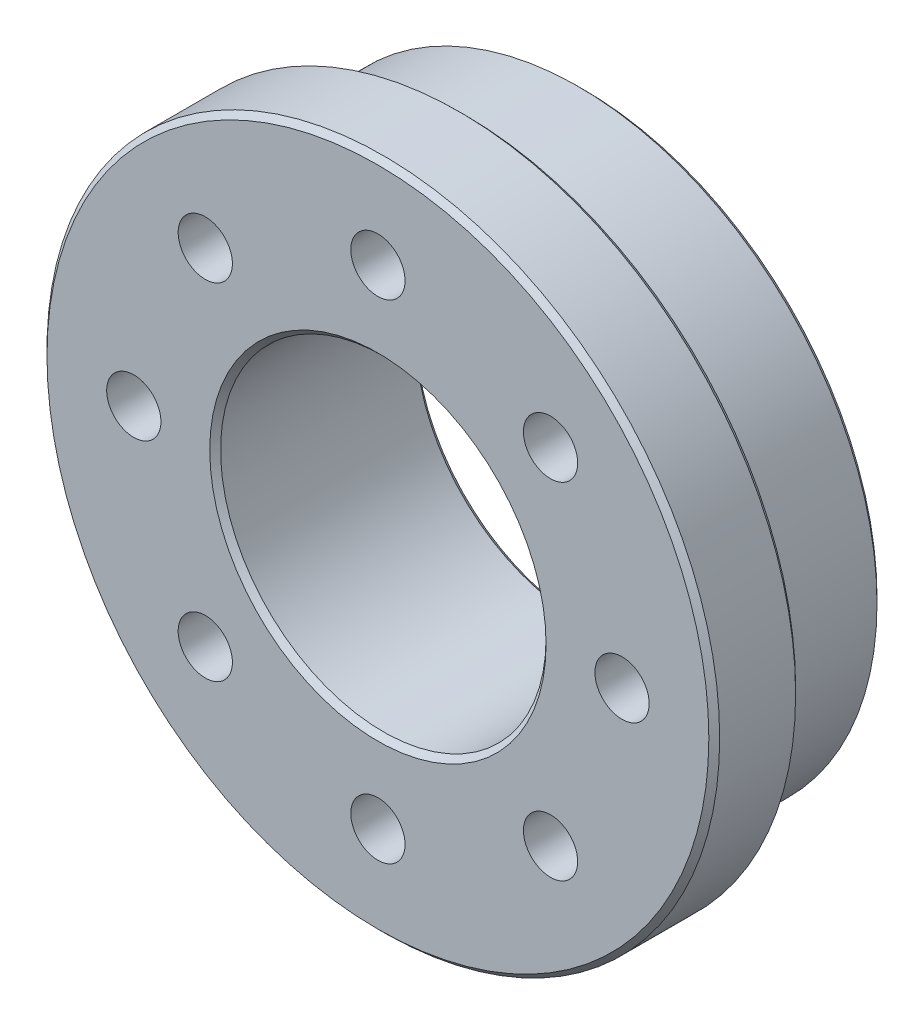
from build123d import *

# Parameters (mm, degrees)
SKETCH_1_R          = 27.5
EXTRUDE_1_DEPTH     = 11
SKETCH_2_R          = 31
EXTRUDE_2_DEPTH     = 8
SKETCH_3_R          = 2.5
CUT_EXTRUDE_1_DEPTH = 15
SKETCH_4_R          = 15
CUT_EXTRUDE_2_DEPTH = 48.780749262
CHAMFER_1_SIZE      = 0.5
CHAMFER_2_SIZE      = 0.5


with BuildPart() as part:
    # 草图1 → 拉伸1 (new body)
    with BuildSketch(Plane.XY):
        Circle(SKETCH_1_R)
    extrude(amount=EXTRUDE_1_DEPTH)

    # 草图2 → 拉伸2 (add)
    with BuildSketch(Plane.XY.offset(11)):
        Circle(SKETCH_2_R)
    extrude(amount=EXTRUDE_2_DEPTH)

    # 草图3 → 切除-拉伸1 (cut)
    with BuildSketch(Plane.XY.offset(19)):
        with Locations((0, 22.5)):
            Circle(SKETCH_3_R)
        with Locations((15.909902577, 15.909902577)):
            Circle(SKETCH_3_R)
        with Locations((22.5, 0)):
            Circle(SKETCH_3_R)
        with Locations((15.909902577, -15.909902577)):
            Circle(SKETCH_3_R)
        with Locations((0, -22.5)):
            Circle(SKETCH_3_R)
        with Locations((-15.909902577, -15.909902577)):
            Circle(SKETCH_3_R)
        with Locations((-22.5, 0)):
            Circle(SKETCH_3_R)
        with Locations((-15.909902577, 15.909902577)):
            Circle(SKETCH_3_R)
    extrude(amount=-CUT_EXTRUDE_1_DEPTH, mode=Mode.SUBTRACT)

    # 草图4 → 切除-拉伸2 (cut, through all)
    with BuildSketch(Plane.XY.offset(19)):
        Circle(SKETCH_4_R)
    extrude(amount=-CUT_EXTRUDE_2_DEPTH, mode=Mode.SUBTRACT)

    # 倒角1
    chamfer_1_edges = [part.edges().sort_by_distance(p)[0] for p in [
        (-27.5, 0, 0),
        (-15, 0, 0),
        (-31, 0, 11),
        (-31, 0, 19),
    ]]
    chamfer(chamfer_1_edges, length=CHAMFER_1_SIZE)

    # 倒角2
    chamfer_2_edges = [part.edges().sort_by_distance(p)[0] for p in [
        (-15, 0, 19),
    ]]
    chamfer(chamfer_2_edges, length=CHAMFER_2_SIZE)


solid = part.part
